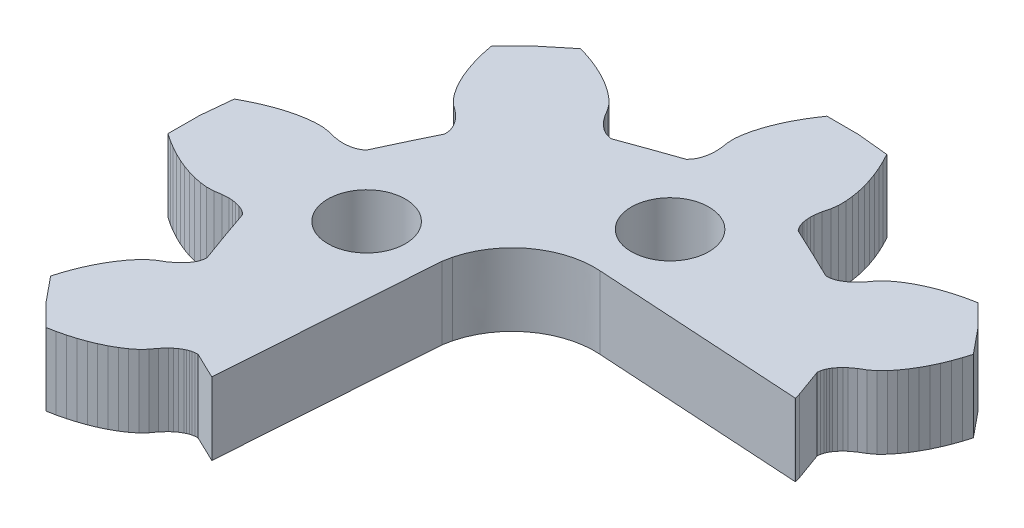
from build123d import *

# Parameters (mm, degrees)
SKETCH1_R           = 1.7
BOSS_EXTRUDE1_DEPTH = 3.175


with BuildPart() as part:
    # Sketch1 → Boss-Extrude1 (new body)
    with BuildSketch(Plane(origin=(0, 0, 0), x_dir=(1, 0, 0), z_dir=(0, 1, 0))):
        with BuildLine():
            Line((-0.734138583, -11.502332221), (-1.390600698, -20.947942857))
            Line((-1.390600698, -20.947942857), (-2.545643814, -20.390794951))
            Line((-2.545643814, -20.390794951), (-2.679872823, -20.394252221))
            Line((-2.679872823, -20.394252221), (-2.78848241, -20.413823887))
            Line((-2.78848241, -20.413823887), (-2.883424405, -20.441599245))
            Line((-2.883424405, -20.441599245), (-2.969227051, -20.475527373))
            Line((-2.969227051, -20.475527373), (-3.048385999, -20.513615945))
            Line((-3.048385999, -20.513615945), (-3.19181285, -20.600028171))
            Line((-3.19181285, -20.600028171), (-3.320421769, -20.696148099))
            Line((-3.320421769, -20.696148099), (-3.437595535, -20.800471721))
            Line((-3.437595535, -20.800471721), (-3.645295163, -21.027635868))
            Line((-3.645295163, -21.027635868), (-3.824441026, -21.275465508))
            Line((-3.824441026, -21.275465508), (-4.034699671, -21.500813123))
            Line((-4.034699671, -21.500813123), (-4.282583189, -21.698014261))
            Line((-4.282583189, -21.698014261), (-4.554048663, -21.877089146))
            Line((-4.554048663, -21.877089146), (-4.844743328, -22.039991037))
            Line((-4.844743328, -22.039991037), (-5.152429871, -22.187716097))
            Line((-5.152429871, -22.187716097), (-5.475899461, -22.320654978))
            Line((-5.475899461, -22.320654978), (-5.813421713, -22.438807681))
            Line((-5.813421713, -22.438807681), (-6.164426333, -22.542232802))
            Line((-6.164426333, -22.542232802), (-6.527699615, -22.630949875))
            Line((-6.527699615, -22.630949875), (-6.902788248, -22.704607313))
            Line((-6.902788248, -22.704607313), (-7.878943838, -21.72106273))
            Line((-7.878943838, -21.72106273), (-8.756326219, -20.648605749))
            Line((-8.756326219, -20.648605749), (-8.645157614, -20.282291353))
            Line((-8.645157614, -20.282291353), (-8.520194686, -19.929063799))
            Line((-8.520194686, -19.929063799), (-8.381812756, -19.589958316))
            Line((-8.381812756, -19.589958316), (-8.230075191, -19.265404621))
            Line((-8.230075191, -19.265404621), (-8.065240329, -18.956769995))
            Line((-8.065240329, -18.956769995), (-7.887249679, -18.665031069))
            Line((-7.887249679, -18.665031069), (-7.696156858, -18.391613722))
            Line((-7.696156858, -18.391613722), (-7.490626302, -18.139428313))
            Line((-7.490626302, -18.139428313), (-7.269702646, -17.912088372))
            Line((-7.269702646, -17.912088372), (-7.024495131, -17.725766893))
            Line((-7.024495131, -17.725766893), (-6.760253397, -17.572103922))
            Line((-6.760253397, -17.572103922), (-6.513578711, -17.388536539))
            Line((-6.513578711, -17.388536539), (-6.398257187, -17.282161995))
            Line((-6.398257187, -17.282161995), (-6.289584234, -17.163872565))
            Line((-6.289584234, -17.163872565), (-6.18940722, -17.029664064))
            Line((-6.18940722, -17.029664064), (-6.143408267, -16.954717475))
            Line((-6.143408267, -16.954717475), (-6.101050431, -16.872524291))
            Line((-6.101050431, -16.872524291), (-6.063547417, -16.780740599))
            Line((-6.063547417, -16.780740599), (-6.033516734, -16.674366055))
            Line((-6.033516734, -16.674366055), (-6.016266518, -16.540860728))
            Line((-6.016266518, -16.540860728), (-6.452181783, -15.33347254))
            Line((-6.452181783, -15.33347254), (-6.87576502, -14.121103539))
            Line((-6.87576502, -14.121103539), (-6.973256284, -14.028616674))
            Line((-6.973256284, -14.028616674), (-7.063596921, -13.965252917))
            Line((-7.063596921, -13.965252917), (-7.150549907, -13.917769165))
            Line((-7.150549907, -13.917769165), (-7.235070606, -13.880891614))
            Line((-7.235070606, -13.880891614), (-7.318065644, -13.851905235))
            Line((-7.318065644, -13.851905235), (-7.48015139, -13.811257892))
            Line((-7.48015139, -13.811257892), (-7.639171188, -13.788228956))
            Line((-7.639171188, -13.788228956), (-7.795631969, -13.778931438))
            Line((-7.795631969, -13.778931438), (-8.102743342, -13.792565193))
            Line((-8.102743342, -13.792565193), (-8.404297991, -13.840634924))
            Line((-8.404297991, -13.840634924), (-8.711989409, -13.851319256))
            Line((-8.711989409, -13.851319256), (-9.026573113, -13.815027684))
            Line((-9.026573113, -13.815027684), (-9.344934416, -13.74935908))
            Line((-9.344934416, -13.74935908), (-9.665459916, -13.658669214))
            Line((-9.665459916, -13.658669214), (-9.987335603, -13.545067608))
            Line((-9.987335603, -13.545067608), (-10.309844951, -13.410077804))
            Line((-10.309844951, -13.410077804), (-10.632032595, -13.254422507))
            Line((-10.632032595, -13.254422507), (-10.953138139, -13.079176013))
            Line((-10.953138139, -13.079176013), (-11.272771639, -12.884357852))
            Line((-11.272771639, -12.884357852), (-11.589850995, -12.670768862))
            Line((-11.589850995, -12.670768862), (-11.585893048, -11.284110464))
            Line((-11.585893048, -11.284110464), (-11.449363359, -9.90380016))
            Line((-11.449363359, -9.90380016), (-11.112157938, -9.723611918))
            Line((-11.112157938, -9.723611918), (-10.774567445, -9.562526559))
            Line((-10.774567445, -9.562526559), (-10.437171925, -9.420622214))
            Line((-10.437171925, -9.420622214), (-10.100863378, -9.298758317))
            Line((-10.100863378, -9.298758317), (-9.766343706, -9.197110662))
            Line((-9.766343706, -9.197110662), (-9.434568277, -9.116929336))
            Line((-9.434568277, -9.116929336), (-9.106628936, -9.059249566))
            Line((-9.106628936, -9.059249566), (-8.783349446, -9.026219938))
            Line((-8.783349446, -9.026219938), (-8.466591794, -9.02225482))
            Line((-8.466591794, -9.02225482), (-8.161586127, -9.063995988))
            Line((-8.161586127, -9.063995988), (-7.866421711, -9.142712369))
            Line((-7.866421711, -9.142712369), (-7.562181312, -9.187520155))
            Line((-7.562181312, -9.187520155), (-7.405847263, -9.194044044))
            Line((-7.405847263, -9.194044044), (-7.245423661, -9.187324829))
            Line((-7.245423661, -9.187324829), (-7.079696798, -9.163377861))
            Line((-7.079696798, -9.163377861), (-6.994405956, -9.142907695))
            Line((-6.994405956, -9.142907695), (-6.906556096, -9.114546359))
            Line((-6.906556096, -9.114546359), (-6.815323458, -9.076281994))
            Line((-6.815323458, -9.076281994), (-6.718787561, -9.022586874))
            Line((-6.718787561, -9.022586874), (-6.612478653, -8.94039369))
            Line((-6.612478653, -8.94039369), (-6.068465605, -7.777617962))
            Line((-6.068465605, -7.777617962), (-5.512442233, -6.620487156))
            Line((-5.512442233, -6.620487156), (-5.515893251, -6.486220058))
            Line((-5.515893251, -6.486220058), (-5.535122442, -6.377150015))
            Line((-5.535122442, -6.377150015), (-5.563169276, -6.282104379))
            Line((-5.563169276, -6.282104379), (-5.596841075, -6.196082805))
            Line((-5.596841075, -6.196082805), (-5.634851018, -6.116839044))
            Line((-5.634851018, -6.116839044), (-5.721102101, -5.973079101))
            Line((-5.721102101, -5.973079101), (-5.817062829, -5.844300664))
            Line((-5.817062829, -5.844300664), (-5.921012566, -5.726929266))
            Line((-5.921012566, -5.726929266), (-6.147941384, -5.518985197))
            Line((-6.147941384, -5.518985197), (-6.395127873, -5.339382933))
            Line((-6.395127873, -5.339382933), (-6.62027269, -5.128938691))
            Line((-6.62027269, -5.128938691), (-6.817112333, -4.88034728))
            Line((-6.817112333, -4.88034728), (-6.995873126, -4.608375346))
            Line((-6.995873126, -4.608375346), (-7.158470675, -4.317222398))
            Line((-7.158470675, -4.317222398), (-7.305923714, -4.008978425))
            Line((-7.305923714, -4.008978425), (-7.438685553, -3.684932577))
            Line((-7.438685553, -3.684932577), (-7.556561221, -3.346530267))
            Line((-7.556561221, -3.346530267), (-7.660125887, -2.995275506))
            Line((-7.660125887, -2.995275506), (-7.748546043, -2.631168294))
            Line((-7.748546043, -2.631168294), (-7.82201666, -2.255654043))
            Line((-7.82201666, -2.255654043), (-6.840304345, -1.277715317))
            Line((-6.840304345, -1.277715317), (-5.769465099, -0.398494356))
            Line((-5.769465099, -0.398494356), (-5.40376928, -0.509927844))
            Line((-5.40376928, -0.509927844), (-5.051550954, -0.635112283))
            Line((-5.051550954, -0.635112283), (-4.712873488, -0.773696086))
            Line((-4.712873488, -0.773696086), (-4.389087068, -0.925894111))
            Line((-4.389087068, -0.925894111), (-4.080825356, -1.090827393))
            Line((-4.080825356, -1.090827393), (-3.789428789, -1.269218636))
            Line((-3.789428789, -1.269218636), (-3.516881215, -1.460970179))
            Line((-3.516881215, -1.460970179), (-3.264966636, -1.666550802))
            Line((-3.264966636, -1.666550802), (-3.038227916, -1.887874702))
            Line((-3.038227916, -1.887874702), (-2.852053284, -2.13351669))
            Line((-2.852053284, -2.13351669), (-2.698848548, -2.39824203))
            Line((-2.698848548, -2.39824203), (-2.515423032, -2.645681017))
            Line((-2.515423032, -2.645681017), (-2.409304223, -2.761079623))
            Line((-2.409304223, -2.761079623), (-2.29117509, -2.869759014))
            Line((-2.29117509, -2.869759014), (-2.157199545, -2.970254245))
            Line((-2.157199545, -2.970254245), (-2.082193517, -3.016155857))
            Line((-2.082193517, -3.016155857), (-2.000353693, -3.058639264))
            Line((-2.000353693, -3.058639264), (-1.908735984, -3.096219988))
            Line((-1.908735984, -3.096219988), (-1.802617174, -3.126495519))
            Line((-1.802617174, -3.126495519), (-1.669475138, -3.14370374))
            Line((-1.669475138, -3.14370374), (-0.463895078, -2.706818058))
            Line((-0.463895078, -2.706818058), (0.746028001, -2.282648098))
            Line((0.746028001, -2.282648098), (0.838410978, -2.185043692))
            Line((0.838410978, -2.185043692), (0.901470049, -2.094353826))
            Line((0.901470049, -2.094353826), (0.94887768, -2.007238426))
            Line((0.94887768, -2.007238426), (0.98580065, -1.922506004))
            Line((0.98580065, -1.922506004), (1.014997824, -1.839609646))
            Line((1.014997824, -1.839609646), (1.055376686, -1.677039809))
            Line((1.055376686, -1.677039809), (1.0783786, -1.517927243))
            Line((1.0783786, -1.517927243), (1.087771414, -1.361178121))
            Line((1.087771414, -1.361178121), (1.074035581, -1.053266202))
            Line((1.074035581, -1.053266202), (1.025862682, -0.751214062))
            Line((1.025862682, -0.751214062), (1.015382895, -0.442970088))
            Line((1.015382895, -0.442970088), (1.05173557, -0.1280069))
            Line((1.05173557, -0.1280069), (1.117158686, 0.190980004))
            Line((1.117158686, 0.190980004), (1.207689422, 0.512291288))
            Line((1.207689422, 0.512291288), (1.321027098, 0.834676865))
            Line((1.321027098, 0.834676865), (1.455767911, 1.157765615))
            Line((1.455767911, 1.157765615), (1.611019861, 1.48036605))
            Line((1.611019861, 1.48036605), (1.786134663, 1.80224378))
            Line((1.786134663, 1.80224378), (1.980420163, 2.122265912))
            Line((1.980420163, 2.122265912), (2.193808121, 2.44015899))
            Line((2.193808121, 2.44015899), (3.578148974, 2.435939948))
            Line((3.578148974, 2.435939948), (4.955782762, 2.299172677))
            Line((4.955782762, 2.299172677), (5.135630528, 1.961532139))
            Line((5.135630528, 1.961532139), (5.296434328, 1.623344688))
            Line((5.296434328, 1.623344688), (5.438013811, 1.285333031))
            Line((5.438013811, 1.285333031), (5.559720694, 0.948415199))
            Line((5.559720694, 0.948415199), (5.66117478, 0.613352964))
            Line((5.66117478, 0.613352964), (5.741230603, 0.280986229))
            Line((5.741230603, 0.280986229), (5.798791442, -0.047806041))
            Line((5.798791442, -0.047806041), (5.831761339, -0.37148077))
            Line((5.831761339, -0.37148077), (5.835719286, -0.688826935))
            Line((5.835719286, -0.688826935), (5.794063352, -0.994316812))
            Line((5.794063352, -0.994316812), (5.715479573, -1.290079454))
            Line((5.715479573, -1.290079454), (5.670757692, -1.594866158))
            Line((5.670757692, -1.594866158), (5.664245601, -1.751810605))
            Line((5.664245601, -1.751810605), (5.670952665, -1.912329519))
            Line((5.670952665, -1.912329519), (5.694846579, -2.0781613))
            Line((5.694846579, -2.0781613), (5.715289475, -2.163792222))
            Line((5.715289475, -2.163792222), (5.743399675, -2.251806122))
            Line((5.743399675, -2.251806122), (5.781799564, -2.343277291))
            Line((5.781799564, -2.343277291), (5.835402455, -2.439787872))
            Line((5.835402455, -2.439787872), (5.91724228, -2.546299144))
            Line((5.91724228, -2.546299144), (7.07791036, -3.091473566))
            Line((7.07791036, -3.091473566), (8.233016841, -3.648641005))
            Line((8.233016841, -3.648641005), (8.367372583, -3.644988409))
            Line((8.367372583, -3.644988409), (8.476045536, -3.625592536))
            Line((8.476045536, -3.625592536), (8.570924165, -3.597621852))
            Line((8.570924165, -3.597621852), (8.656790177, -3.563713257))
            Line((8.656790177, -3.563713257), (8.735880885, -3.525624685))
            Line((8.735880885, -3.525624685), (8.87931261, -3.439466383))
            Line((8.87931261, -3.439466383), (9.007921529, -3.343268324))
            Line((9.007921529, -3.343268324), (9.125095295, -3.238944703))
            Line((9.125095295, -3.238944703), (9.332604824, -3.011800088))
            Line((9.332604824, -3.011800088), (9.511745813, -2.763970448))
            Line((9.511745813, -2.763970448), (9.722004459, -2.53868143))
            Line((9.722004459, -2.53868143), (9.970082948, -2.341284966))
            Line((9.970082948, -2.341284966), (10.241611789, -2.162385875))
            Line((10.241611789, -2.162385875), (10.532240651, -1.999444919))
            Line((10.532240651, -1.999444919), (10.839929631, -1.851778457))
            Line((10.839929631, -1.851778457), (11.163396783, -1.718585652))
            Line((11.163396783, -1.718585652), (11.500984839, -1.600491547))
            Line((11.500984839, -1.600491547), (11.851926093, -1.4968711))
            Line((11.851926093, -1.4968711), (12.215260304, -1.408349353))
            Line((12.215260304, -1.408349353), (12.590095472, -1.334496589))
            Line((12.590095472, -1.334496589), (13.566251063, -2.318236497))
            Line((13.566251063, -2.318236497), (14.443889345, -3.390830207))
            Line((14.443889345, -3.390830207), (14.332467276, -3.75712507))
            Line((14.332467276, -3.75712507), (14.207692009, -4.11017683))
            Line((14.207692009, -4.11017683), (14.069183346, -4.449262781))
            Line((14.069183346, -4.449262781), (13.91757495, -4.774031335))
            Line((13.91757495, -4.774031335), (13.752613356, -5.082665961))
            Line((13.752613356, -5.082665961), (13.574747001, -5.374385354))
            Line((13.574747001, -5.374385354), (13.38333735, -5.647626907))
            Line((13.38333735, -5.647626907), (13.17799933, -5.899792784))
            Line((13.17799933, -5.899792784), (12.957007433, -6.127152258))
            Line((12.957007433, -6.127152258), (12.711802355, -6.313454204))
            Line((12.711802355, -6.313454204), (12.447560622, -6.466941382))
            Line((12.447560622, -6.466941382), (12.200949302, -6.650958014))
            Line((12.200949302, -6.650958014), (12.085566848, -6.757078635))
            Line((12.085566848, -6.757078635), (11.976891458, -6.875543859))
            Line((11.976891458, -6.875543859), (11.876777811, -7.009635163))
            Line((11.876777811, -7.009635163), (11.83090559, -7.084718481))
            Line((11.83090559, -7.084718481), (11.788547754, -7.166774937))
            Line((11.788547754, -7.166774937), (11.751237275, -7.258558628))
            Line((11.751237275, -7.258558628), (11.720826396, -7.364855042))
            Line((11.720826396, -7.364855042), (11.703639545, -7.498243173))
            Line((11.703639545, -7.498243173), (12.139681543, -8.706002481))
            Line((12.139681543, -8.706002481), (12.218326251, -8.959652835))
            Line((12.218326251, -8.959652835), (12.185168692, -8.959652835))
            Line((12.185168692, -8.959652835), (3.085018394, -8.405981364))
            add(Edge.make_bspline(
                [(3.085018394, -8.405981364), (1.379478154, -8.289619907), (-0.219458779, -9.403533916), (-0.658180578, -11.122302399)],
                knots=[1.112910324, 1.112910324, 1.112910324, 1.112910324, 2, 2, 2, 2], degree=3))
            add(Edge.make_bspline(
                [(-0.658180578, -11.122302399), (-0.690518292, -11.248970922), (-0.715754317, -11.375788304), (-0.734138583, -11.502332221)],
                knots=[2, 2, 2, 2, 2.065378053, 2.065378053, 2.065378053, 2.065378053], degree=3))
        make_face()
        with Locations(Location((3.051834579, -5.296469809, 0), (0, 0, 270))):
            Circle(SKETCH1_R, mode=Mode.SUBTRACT)
        with Locations(Location((-3.902639733, -11.646889459, 0), (0, 0, 270))):
            Circle(SKETCH1_R, mode=Mode.SUBTRACT)
    extrude(amount=BOSS_EXTRUDE1_DEPTH)


solid = part.part
